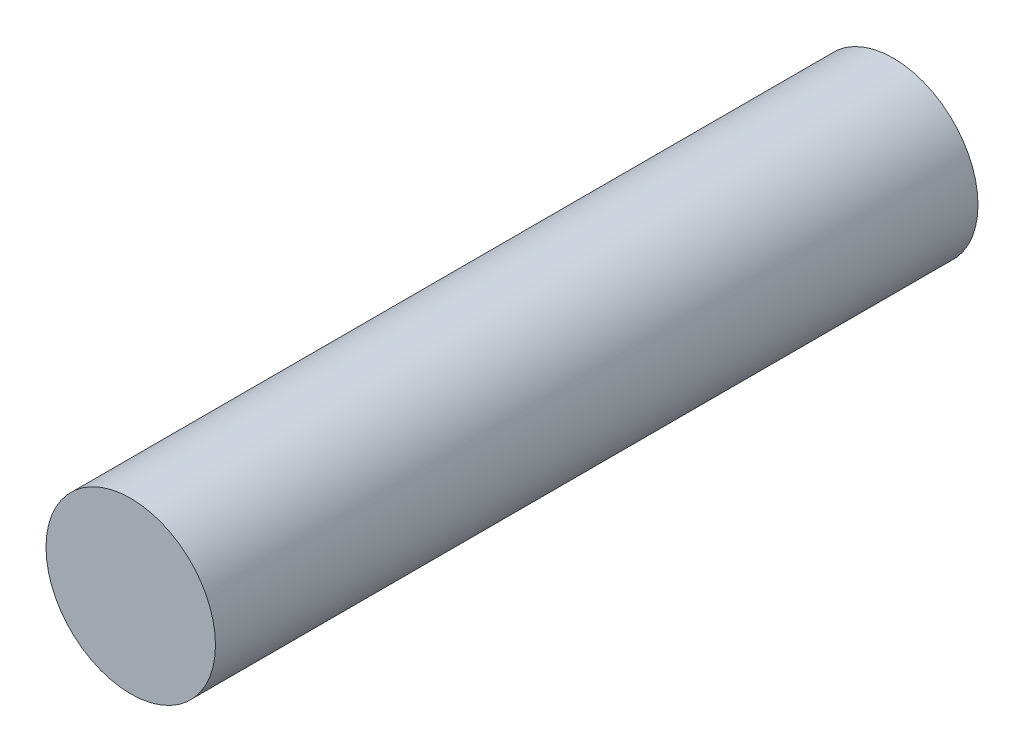
from build123d import *

# Parameters (mm, degrees)
SKETCH1_R           = 2.778125
BOSS_EXTRUDE1_DEPTH = 25


with BuildPart() as part:
    # Sketch1 → Boss-Extrude1 (new body)
    with BuildSketch(Plane.XY):
        Circle(SKETCH1_R)
    extrude(amount=BOSS_EXTRUDE1_DEPTH)


solid = part.part
